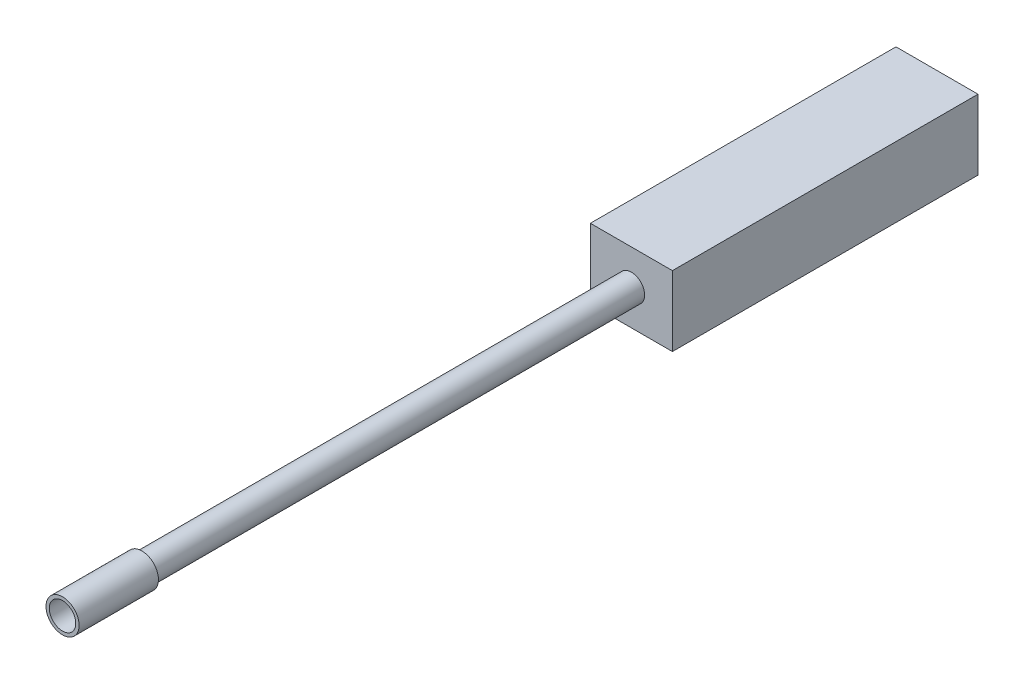
from build123d import *

# Parameters (mm, degrees)
SKETCH1_W           = 157.48
SKETCH1_H           = 134.62
BOSS_EXTRUDE1_DEPTH = 586.74
SKETCH2_R           = 25.4
SKETCH2_R_2         = 6.35
BOSS_EXTRUDE2_DEPTH = 1016
SKETCH3_R           = 31.75
SKETCH3_R_2         = 25.4
BOSS_EXTRUDE3_DEPTH = 76.2


with BuildPart() as part:
    # Sketch1 → Boss-Extrude1 (new body)
    with BuildSketch(Plane.XY):
        with Locations((78.74, 67.31)):
            Rectangle(SKETCH1_W, SKETCH1_H)
    extrude(amount=BOSS_EXTRUDE1_DEPTH)

    # Sketch2 → Boss-Extrude2 (add)
    with BuildSketch(Plane.XY.offset(586.74)):
        with Locations((78.74, 67.31)):
            Circle(SKETCH2_R)
        with Locations((78.74, 67.31)):
            Circle(SKETCH2_R_2, mode=Mode.SUBTRACT)
    extrude(amount=BOSS_EXTRUDE2_DEPTH)

    # Sketch3 → Boss-Extrude3 (add, symmetric)
    with BuildSketch(Plane.XY.offset(1602.74)):
        with Locations(Location((78.74, 67.31, 0), (0, 0, 180))):
            Circle(SKETCH3_R)
        with Locations((78.74, 67.31)):
            Circle(SKETCH3_R_2, mode=Mode.SUBTRACT)
    extrude(amount=BOSS_EXTRUDE3_DEPTH, both=True)


solid = part.part
